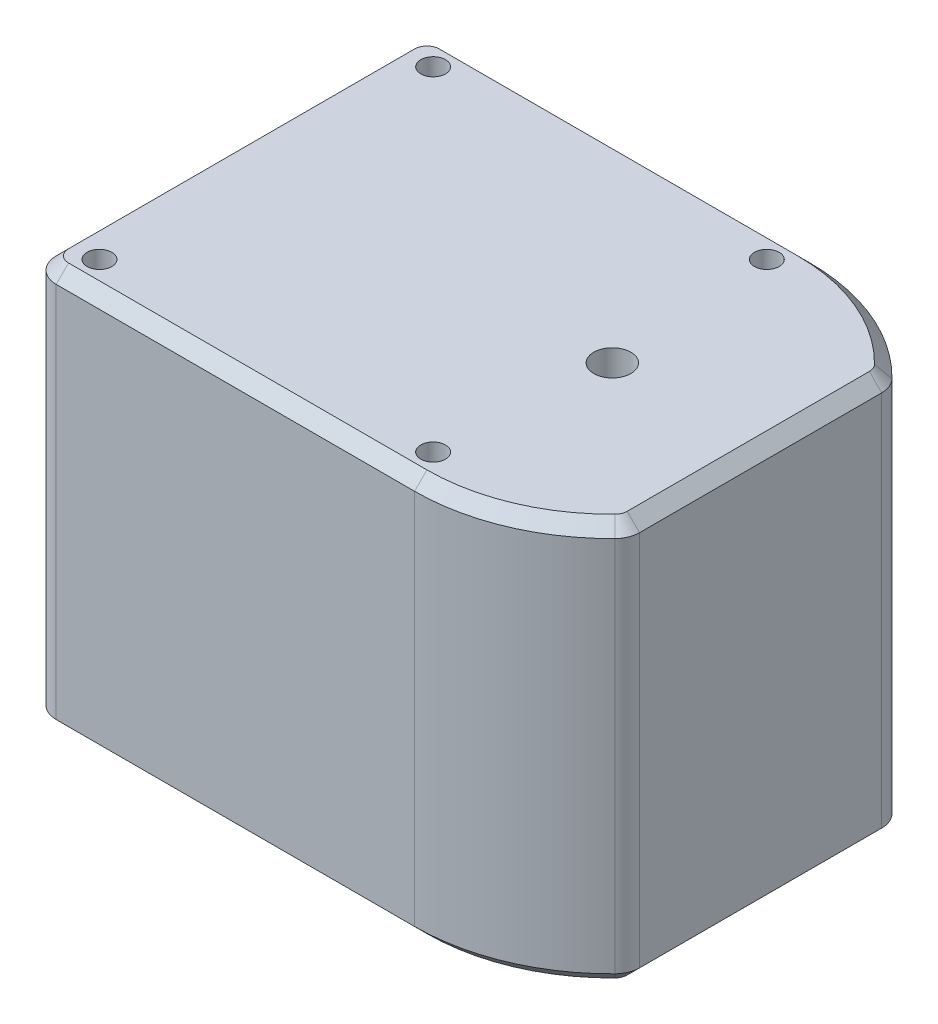
from build123d import *

# Parameters (mm, degrees)
EXTRUDE_1_DEPTH          = 16.25
EXTRUDE_1_DEPTH_BACK     = 16.25
SKETCH_2_R               = 1.5
CUT_EXTRUDE_1_DEPTH      = 39.484574832
CUT_EXTRUDE_1_DEPTH_BACK = 39.484574832
SKETCH_3_R               = 1
FILLET_1_R               = 2
CHAMFER_1_SIZE           = 1
SKETCH_4_W               = 8.5
SKETCH_4_H               = 4
CUT_EXTRUDE_2_DEPTH      = 39.484574832


with BuildPart() as part:
    # Эскиз2 → Бобышка-Вытянуть1 (new, two sides: drawn at the far end of the back side and taken through both)
    with BuildSketch(Plane(origin=(0, 0, 0), x_dir=(1, 0, 0), z_dir=(0, 1, 0)).offset(-EXTRUDE_1_DEPTH_BACK)):
        with BuildLine():
            Line((-31, 16), (-31, -16))
            Line((-31, -16), (0, -16))
            ThreePointArc((0, -16), (6.583005244, -14.583005244), (12, -10.583005244))
            Line((12, -10.583005244), (12, 10.583005244))
            ThreePointArc((12, 10.583005244), (6.583005244, 14.583005244), (0, 16))
            Line((0, 16), (-31, 16))
        make_face()
        Circle(SKETCH_2_R, mode=Mode.SUBTRACT)
    extrude(amount=EXTRUDE_1_DEPTH + EXTRUDE_1_DEPTH_BACK)

    # Эскиз3 → Вырез-Вытянуть1 (cut, two sides: drawn at the far end of the back side and taken through both)
    with BuildSketch(Plane(origin=(0, 0, 0), x_dir=(1, 0, 0), z_dir=(0, 1, 0)).offset(-CUT_EXTRUDE_1_DEPTH_BACK)):
        with Locations((-28, 13.5)):
            Circle(SKETCH_3_R)
        with Locations((-1, 13.5)):
            Circle(SKETCH_3_R)
        with Locations((-1, -13.5)):
            Circle(SKETCH_3_R)
        with Locations((-28, -13.5)):
            Circle(SKETCH_3_R)
    extrude(amount=CUT_EXTRUDE_1_DEPTH + CUT_EXTRUDE_1_DEPTH_BACK, mode=Mode.SUBTRACT)

    # Скругление1
    fillet_1_edges = [part.edges().sort_by_distance(p)[0] for p in [
        (12, 0, -10.583005244),
        (12, 0, 10.583005244),
        (-31, 0, -16),
        (-31, 0, 16),
    ]]
    fillet(fillet_1_edges, radius=FILLET_1_R)

    # Фаска1
    chamfer_1_edges = [part.edges().sort_by_distance(p)[0] for p in [
        (6.198278861, -16.25, -14.750638602),
        (-14.5, -16.25, -16),
        (11.8516402, -16.25, -10.553887917),
        (-30.414213562, -16.25, -15.414213562),
        (12, -16.25, 0),
        (-31, -16.25, 0),
        (11.8516402, -16.25, 10.553887917),
        (-30.414213562, -16.25, 15.414213562),
        (6.198278861, -16.25, 14.750638602),
        (-14.5, -16.25, 16),
        (6.198278861, 16.25, -14.750638602),
        (-14.5, 16.25, -16),
        (11.8516402, 16.25, -10.553887917),
        (-30.414213562, 16.25, -15.414213562),
        (12, 16.25, 0),
        (-31, 16.25, 0),
        (11.8516402, 16.25, 10.553887917),
        (-30.414213562, 16.25, 15.414213562),
        (6.198278861, 16.25, 14.750638602),
        (-14.5, 16.25, 16),
    ]]
    chamfer(chamfer_1_edges, length=CHAMFER_1_SIZE)

    # Эскиз4 → Вырез-Вытянуть2 (cut, through all)
    with BuildSketch(Plane.XY):
        with Locations((-7.75, -13.15)):
            Rectangle(SKETCH_4_W, SKETCH_4_H)
    extrude(amount=-CUT_EXTRUDE_2_DEPTH, mode=Mode.SUBTRACT)


solid = part.part
